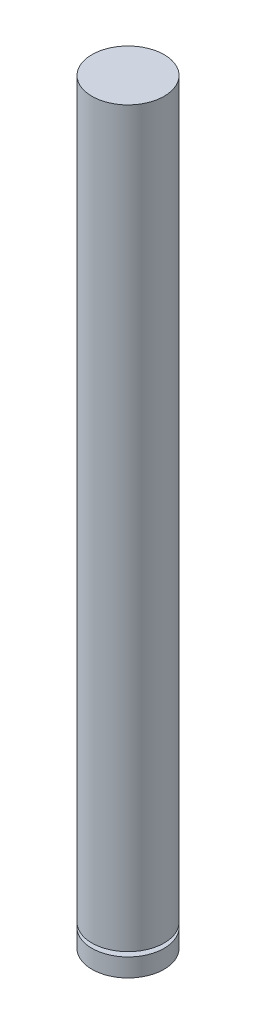
from build123d import *

# Parameters (mm, degrees)
SKETCH1_R           = 1.585
BOSS_EXTRUDE1_DEPTH = 33.2
SKETCH2_W           = 0.5
SKETCH2_H           = 0.2


with BuildPart() as part:
    # Sketch1 → Boss-Extrude1 (new body)
    with BuildSketch(Plane(origin=(0, 0, 0), x_dir=(1, 0, 0), z_dir=(0, 1, 0))):
        with Locations(Location((0, 0, 0), (0, 0, 90))):
            Circle(SKETCH1_R)
    extrude(amount=BOSS_EXTRUDE1_DEPTH)

    # Sketch2 → Cut-Revolve1 (revolve, cut)
    with BuildSketch(Plane.XY, mode=Mode.PRIVATE) as cut_revolve1_sk:
        with Locations((1.335, 0.9)):
            Rectangle(SKETCH2_W, SKETCH2_H)
    revolve(cut_revolve1_sk.sketch.rotate(Axis((0, -1.7, 0), (0, 1, 0)), 90), axis=Axis((0, -1.7, 0), (0, 1, 0)), mode=Mode.SUBTRACT)


solid = part.part
